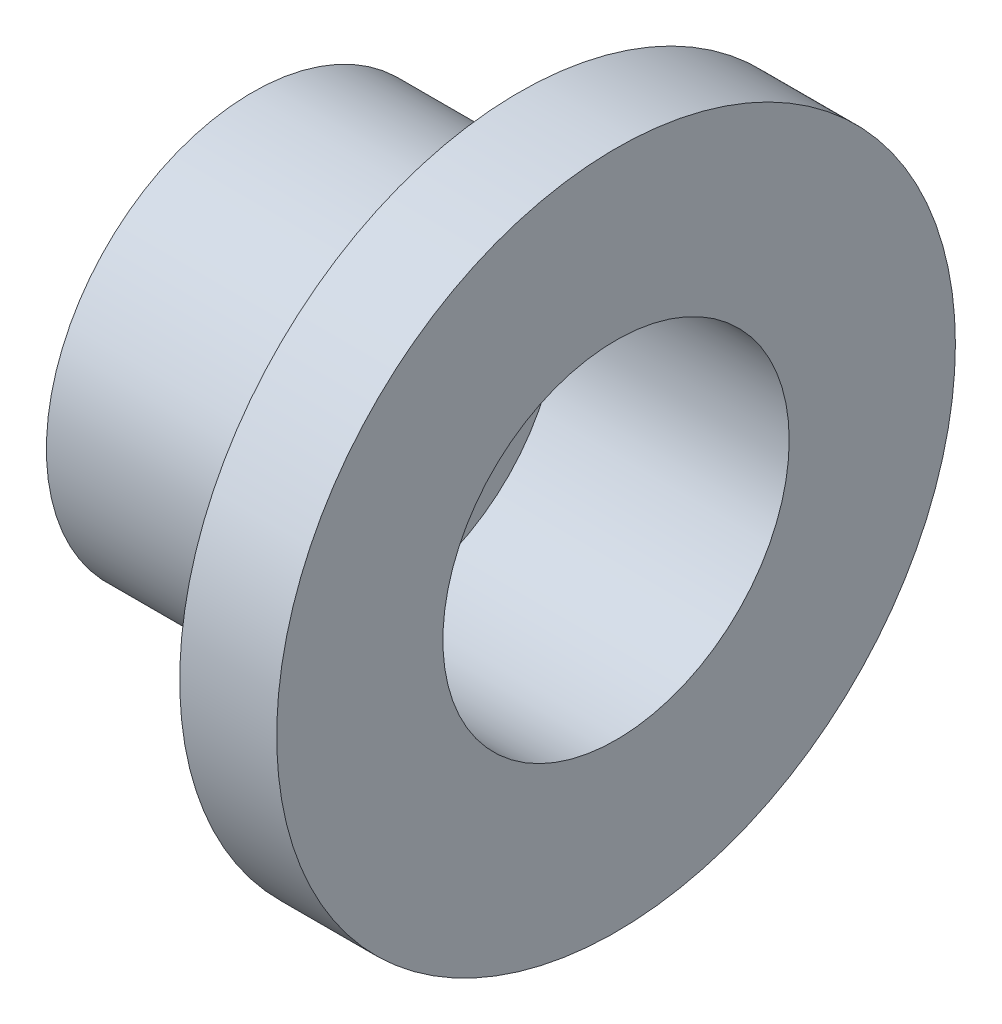
from build123d import *

# Parameters (mm, degrees)
CBORE_FOR_1_4_BINDING_HEAD_MACHINE_SCREW_D           = 6.5278
CBORE_FOR_1_4_BINDING_HEAD_MACHINE_SCREW_DEPTH       = 303
CBORE_FOR_1_4_BINDING_HEAD_MACHINE_SCREW_CBORE_D     = 14.2875
CBORE_FOR_1_4_BINDING_HEAD_MACHINE_SCREW_CBORE_DEPTH = 9.525
CBORE_FOR_1_4_BINDING_HEAD_MACHINE_SCREW_TIP         = 1.961148974


with BuildPart() as part:
    # Sketch1 → Revolve1 (revolve)
    with BuildSketch(Plane.XY, mode=Mode.PRIVATE) as revolve1_sk:
        Polygon((0, 0), (0, 8.5), (11, 8.5), (11, 14), (15, 14), (15, 0), align=None)
    revolve(revolve1_sk.sketch.rotate(Axis((0, 0, 0), (-1, 0, 0)), 90), axis=Axis((0, 0, 0), (-1, 0, 0)))

    # CBORE for 1/4 Binding Head Machine Screw1
    with Locations(Plane(origin=(15, 0, 0), x_dir=(0, 0, -1), z_dir=(1, 0, 0))):
        with Locations((0, 0)):
            CounterBoreHole(CBORE_FOR_1_4_BINDING_HEAD_MACHINE_SCREW_D / 2, CBORE_FOR_1_4_BINDING_HEAD_MACHINE_SCREW_CBORE_D / 2, CBORE_FOR_1_4_BINDING_HEAD_MACHINE_SCREW_CBORE_DEPTH, depth=CBORE_FOR_1_4_BINDING_HEAD_MACHINE_SCREW_DEPTH)
            with Locations((0, 0, -(CBORE_FOR_1_4_BINDING_HEAD_MACHINE_SCREW_DEPTH + CBORE_FOR_1_4_BINDING_HEAD_MACHINE_SCREW_TIP / 2))):  # 118° drill point
                Cone(0, CBORE_FOR_1_4_BINDING_HEAD_MACHINE_SCREW_D / 2, CBORE_FOR_1_4_BINDING_HEAD_MACHINE_SCREW_TIP, mode=Mode.SUBTRACT)


solid = part.part
